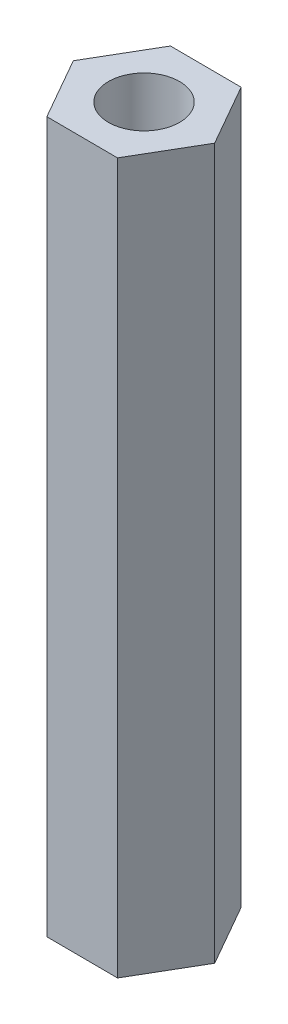
from build123d import *

# Parameters (mm, degrees)
SKETCH_1_R      = 1.5
EXTRUDE_1_DEPTH = 30


with BuildPart() as part:
    # 草图1 → 凸台-拉伸1 (new body)
    with BuildSketch(Plane(origin=(0, 0, 0), x_dir=(1, 0, 0), z_dir=(0, 1, 0))):
        Polygon((1.513237081, 2.590433779), (-1.486762919, 2.605718643), (-3, 0.015284864), (-1.513237081, -2.590433779), (1.486762919, -2.605718643), (3, -0.015284864), align=None)
        with Locations(Location((0, 0, 0), (0, 0, 270))):
            Circle(SKETCH_1_R, mode=Mode.SUBTRACT)
    extrude(amount=EXTRUDE_1_DEPTH)


solid = part.part
